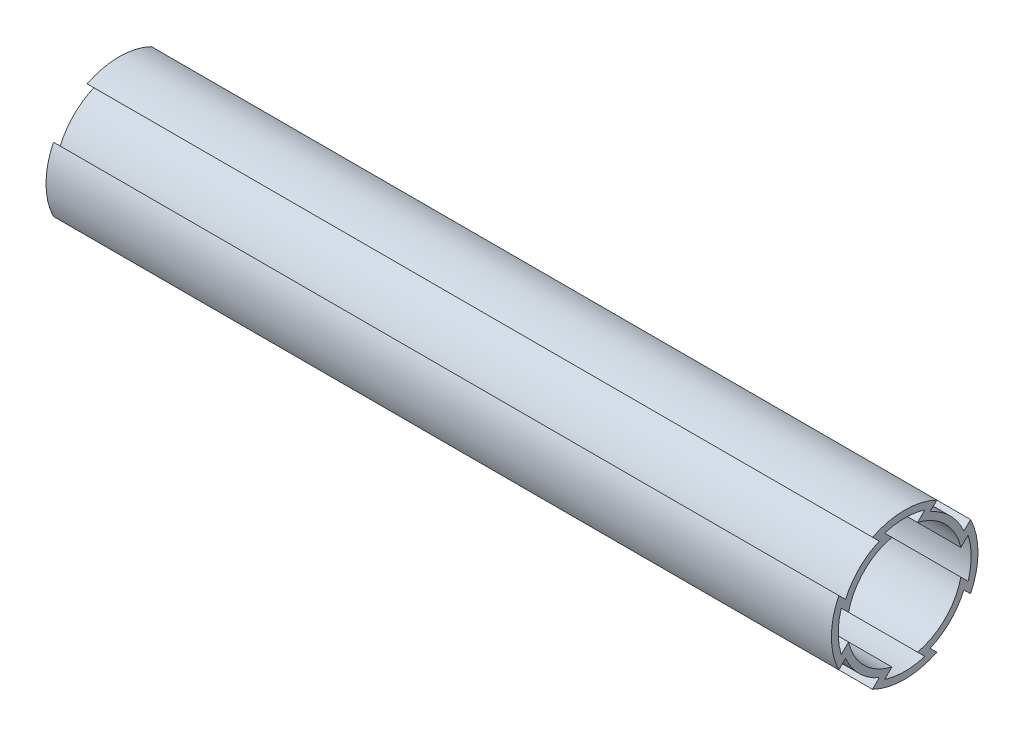
from build123d import *

# Parameters (mm, degrees)
BOSS_EXTRUDE1_DEPTH = 150


with BuildPart() as part:
    # Sketch1 → Boss-Extrude1 (new body)
    with BuildSketch(Plane(origin=(0, 0, 0), x_dir=(0, 0, -1), z_dir=(1, 0, 0))):
        with BuildLine():
            Line((-11.297790668, 4.86311896), (-12.579426967, 6.144755258))
            ThreePointArc((-12.579426967, 6.144755258), (-14, 0), (-12.579426967, -6.144755258))
            Line((-12.579426967, -6.144755258), (-11.297790668, -4.86311896))
            ThreePointArc((-11.297790668, -4.86311896), (-8.697413409, -8.697413409), (-4.86311896, -11.297790668))
            Line((-4.86311896, -11.297790668), (-6.144755258, -12.579426967))
            ThreePointArc((-6.144755258, -12.579426967), (0, -14), (6.144755258, -12.579426967))
            Line((6.144755258, -12.579426967), (4.86311896, -11.297790668))
            ThreePointArc((4.86311896, -11.297790668), (8.697413409, -8.697413409), (11.297790668, -4.86311896))
            Line((11.297790668, -4.86311896), (12.579426967, -6.144755258))
            ThreePointArc((12.579426967, -6.144755258), (13.64023419, -3.153412633), (14, 0))
            ThreePointArc((14, 0), (13.64023419, 3.153412633), (12.579426967, 6.144755258))
            Line((12.579426967, 6.144755258), (11.297790668, 4.86311896))
            ThreePointArc((11.297790668, 4.86311896), (8.697413409, 8.697413409), (4.86311896, 11.297790668))
            Line((4.86311896, 11.297790668), (6.144755258, 12.579426967))
            ThreePointArc((6.144755258, 12.579426967), (0, 14), (-6.144755258, 12.579426967))
            Line((-6.144755258, 12.579426967), (-4.86311896, 11.297790668))
            ThreePointArc((-4.86311896, 11.297790668), (-8.697413409, 8.697413409), (-11.297790668, 4.86311896))
        make_face()
        with BuildLine():
            Line((-10.723588409, 2.450439069), (-12.107380777, 3.834231437))
            ThreePointArc((-12.107380777, 3.834231437), (-12.7, 0), (-12.107380777, -3.834231437))
            Line((-12.107380777, -3.834231437), (-10.723588409, -2.450439069))
            ThreePointArc((-10.723588409, -2.450439069), (-7.778174593, -7.778174593), (-2.450439069, -10.723588409))
            Line((-2.450439069, -10.723588409), (-3.834231437, -12.107380777))
            ThreePointArc((-3.834231437, -12.107380777), (0, -12.7), (3.834231437, -12.107380777))
            Line((3.834231437, -12.107380777), (2.450439069, -10.723588409))
            ThreePointArc((2.450439069, -10.723588409), (7.778174593, -7.778174593), (10.723588409, -2.450439069))
            Line((10.723588409, -2.450439069), (12.107380777, -3.834231437))
            ThreePointArc((12.107380777, -3.834231437), (12.550970797, -1.939879394), (12.7, 0))
            ThreePointArc((12.7, 0), (12.550970797, 1.939879394), (12.107380777, 3.834231437))
            Line((12.107380777, 3.834231437), (10.723588409, 2.450439069))
            ThreePointArc((10.723588409, 2.450439069), (7.778174593, 7.778174593), (2.450439069, 10.723588409))
            Line((2.450439069, 10.723588409), (3.834231437, 12.107380777))
            ThreePointArc((3.834231437, 12.107380777), (0, 12.7), (-3.834231437, 12.107380777))
            Line((-3.834231437, 12.107380777), (-2.450439069, 10.723588409))
            ThreePointArc((-2.450439069, 10.723588409), (-7.778174593, 7.778174593), (-10.723588409, 2.450439069))
        make_face(mode=Mode.SUBTRACT)
    extrude(amount=BOSS_EXTRUDE1_DEPTH)


solid = part.part
